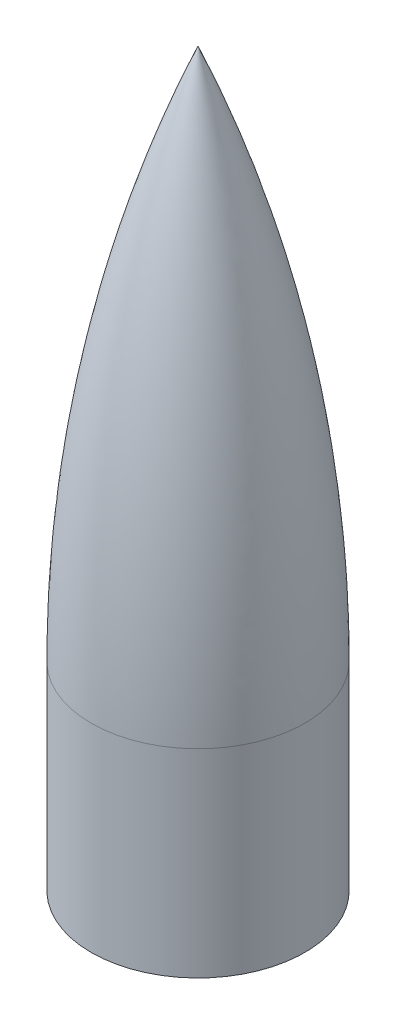
from build123d import *


with BuildPart() as part:
    # Sketch1 → Revolve3 (revolve)
    with BuildSketch(Plane.XY, mode=Mode.PRIVATE) as revolve3_sk:
        with BuildLine():
            Line((0, 400), (0, 402.756656622))
            ThreePointArc((0, 402.756656622), (60.363605816, 205.385909299), (80.75, 0))
            Line((80.75, 0), (80.75, -150))
            Line((80.75, -150), (78.35, -150))
            Line((78.35, -150), (78.35, 0))
            ThreePointArc((78.35, 0), (58.574924408, 202.078213736), (0, 396.489212171))
            Line((0, 396.489212171), (0, 400))
        make_face()
    revolve(revolve3_sk.sketch.rotate(Axis((0, 400, 0), (0, 1, 0)), 270), axis=Axis((0, 400, 0), (0, 1, 0)))


solid = part.part
